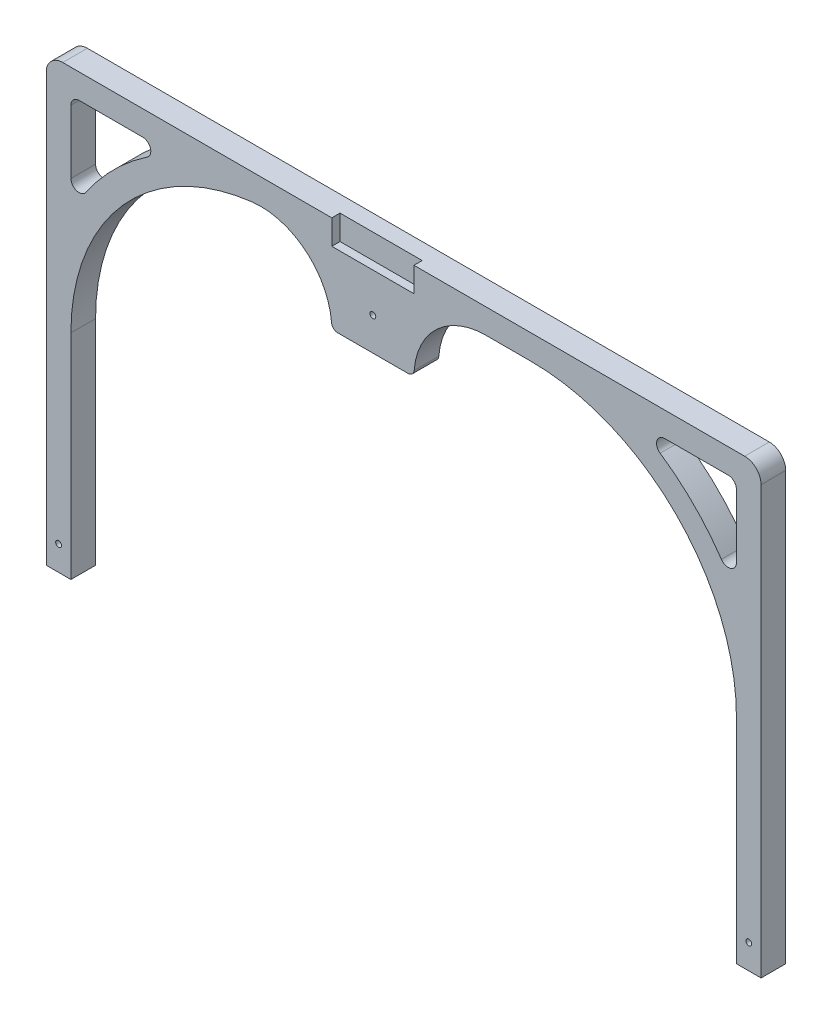
from build123d import *

# Parameters (mm, degrees)
BOSS_EXTRUDE1_DEPTH                            = 19.05
SKETCH2_W                                      = 63.5
SKETCH2_H                                      = 6.35
CUT_EXTRUDE1_DEPTH                             = 441.730714978
BOSS_EXTRUDE3_DEPTH                            = 19.05
FILLET1_R                                      = 4.7625
CSK_FOR_8_FLAT_HEAD_MACHINE_SCREW1_D           = 4.4958
CSK_FOR_8_FLAT_HEAD_MACHINE_SCREW1_DEPTH       = 30.1752
CSK_FOR_8_FLAT_HEAD_MACHINE_SCREW1_CSINK_D     = 8.4328
CSK_FOR_8_FLAT_HEAD_MACHINE_SCREW1_CSINK_ANGLE = 82
CSK_FOR_8_FLAT_HEAD_MACHINE_SCREW1_TIP         = 1.350674586


with BuildPart() as part:
    # Sketch1 → Boss-Extrude1 (new body)
    with BuildSketch(Plane.XY):
        with BuildLine():
            Line((276.225, 0), (276.225, 330.2))
            ThreePointArc((276.225, 330.2), (272.505256121, 339.180256121), (263.525, 342.9))
            Line((263.525, 342.9), (-263.525, 342.9))
            ThreePointArc((-263.525, 342.9), (-272.505256121, 339.180256121), (-276.225, 330.2))
            Line((-276.225, 330.2), (-276.225, 0))
            Line((-276.225, 0), (-257.175, 0))
            Line((-257.175, 0), (-257.175, 76.2))
            Line((-257.175, 76.2), (-257.175, 165.1))
            ThreePointArc((-257.175, 165.1), (-210.678201513, 277.353201513), (-98.425, 323.85))
            Line((-98.425, 323.85), (98.425, 323.85))
            ThreePointArc((98.425, 323.85), (210.678201513, 277.353201513), (257.175, 165.1))
            Line((257.175, 165.1), (257.175, 76.2))
            Line((257.175, 76.2), (257.175, 0))
            Line((257.175, 0), (276.225, 0))
        make_face()
        with BuildLine():
            Line((250.825, 323.85), (201.795510785, 323.85))
            ThreePointArc((201.795510785, 323.85), (195.725385382, 319.364424197), (198.231010413, 312.244827586))
            ThreePointArc((198.231010413, 312.244827586), (224.148585695, 290.823585695), (245.569827586, 264.906010413))
            ThreePointArc((245.569827586, 264.906010413), (252.689424197, 262.400385382), (257.175, 268.470510785))
            Line((257.175, 268.470510785), (257.175, 317.5))
            ThreePointArc((257.175, 317.5), (255.315128061, 321.990128061), (250.825, 323.85))
        make_face(mode=Mode.SUBTRACT)
        with BuildLine():
            Line((-250.825, 323.85), (-201.795510785, 323.85))
            ThreePointArc((-201.795510785, 323.85), (-195.725385382, 319.364424197), (-198.231010413, 312.244827586))
            ThreePointArc((-198.231010413, 312.244827586), (-224.148585695, 290.823585695), (-245.569827586, 264.906010413))
            ThreePointArc((-245.569827586, 264.906010413), (-252.689424197, 262.400385382), (-257.175, 268.470510785))
            Line((-257.175, 268.470510785), (-257.175, 317.5))
            ThreePointArc((-257.175, 317.5), (-255.315128061, 321.990128061), (-250.825, 323.85))
        make_face(mode=Mode.SUBTRACT)
    extrude(amount=BOSS_EXTRUDE1_DEPTH)

    # Sketch2 → Cut-Extrude1 (cut, through all)
    with BuildSketch(Plane(origin=(0, 342.9, 0), x_dir=(1, 0, 0), z_dir=(0, 1, 0))):
        with Locations((-23.8125, -15.875)):
            Rectangle(SKETCH2_W, SKETCH2_H)
    extrude(amount=-CUT_EXTRUDE1_DEPTH, mode=Mode.SUBTRACT)

    # Sketch3 → Boss-Extrude3 (add)
    with BuildSketch(Plane.XY):
        with BuildLine():
            ThreePointArc((-116.873274525, 322.774422996), (-73.976886998, 309.253399344), (-55.5625, 268.21892))
            Line((-55.5625, 268.21892), (7.9375, 268.21892))
            ThreePointArc((7.9375, 268.21892), (24.231466087, 307.556033913), (63.56858, 323.85))
            Line((63.56858, 323.85), (7.9375, 323.85))
            Line((7.9375, 323.85), (-55.5625, 323.85))
            Line((-55.5625, 323.85), (-98.425, 323.85))
            ThreePointArc((-98.425, 323.85), (-107.664801119, 323.580877633), (-116.873274525, 322.774422996))
        make_face()
    extrude(amount=BOSS_EXTRUDE3_DEPTH)

    # Fillet1
    fillet1_edges = [part.edges().sort_by_distance(p)[0] for p in [
        (-55.5625, 268.21892, 9.525),
        (7.9375, 268.21892, 9.525),
    ]]
    fillet(fillet1_edges, radius=FILLET1_R)

    # CSK for #8 Flat Head Machine Screw1
    with Locations(Plane(origin=(0, 0, 0), x_dir=(-1, 0, 0), z_dir=(0, 0, -1))):
        with Locations((23.813611707, 293.61892), (266.7, 19.05), (-266.7, 19.05)):
            CounterSinkHole(CSK_FOR_8_FLAT_HEAD_MACHINE_SCREW1_D / 2, CSK_FOR_8_FLAT_HEAD_MACHINE_SCREW1_CSINK_D / 2, depth=CSK_FOR_8_FLAT_HEAD_MACHINE_SCREW1_DEPTH, counter_sink_angle=CSK_FOR_8_FLAT_HEAD_MACHINE_SCREW1_CSINK_ANGLE)
            with Locations((0, 0, -(CSK_FOR_8_FLAT_HEAD_MACHINE_SCREW1_DEPTH + CSK_FOR_8_FLAT_HEAD_MACHINE_SCREW1_TIP / 2))):  # 118° drill point
                Cone(0, CSK_FOR_8_FLAT_HEAD_MACHINE_SCREW1_D / 2, CSK_FOR_8_FLAT_HEAD_MACHINE_SCREW1_TIP, mode=Mode.SUBTRACT)


solid = part.part
